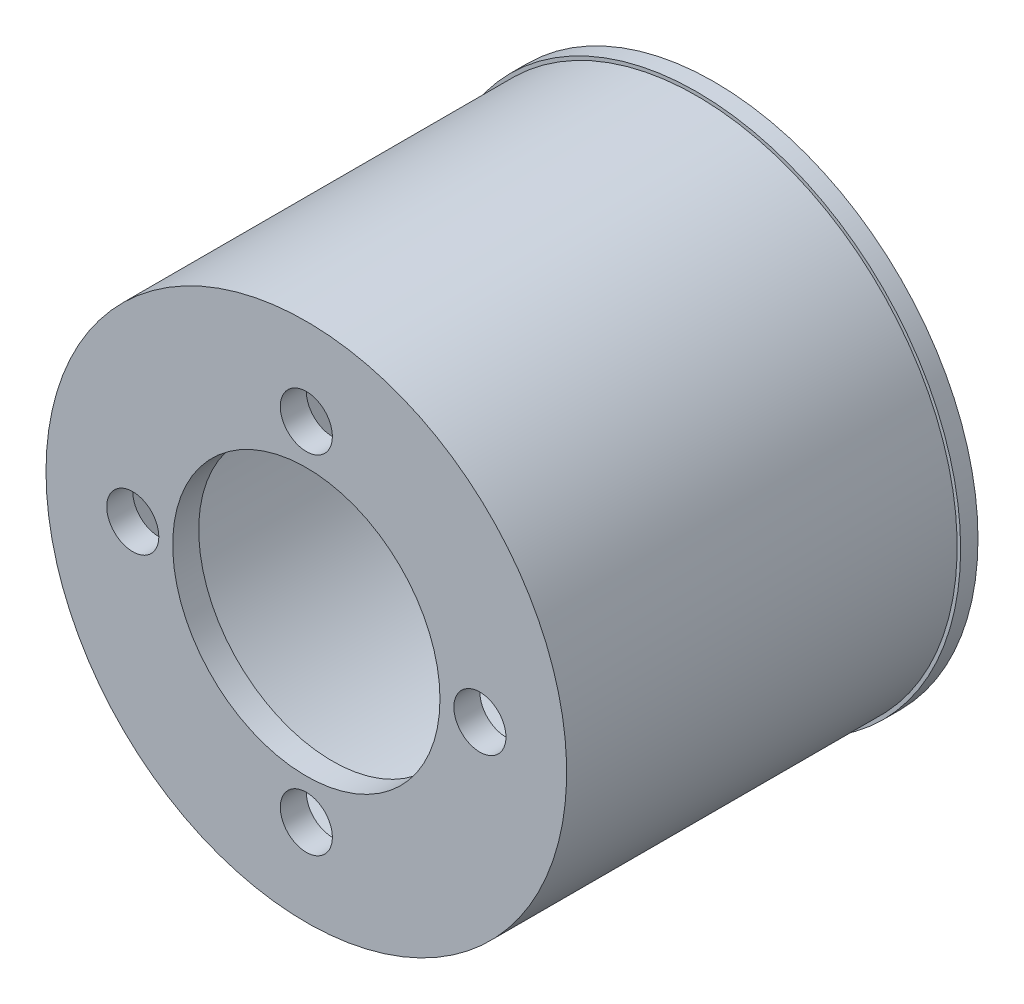
from build123d import *

# Parameters (mm, degrees)
ESQUISSE1_R        = 15
ESQUISSE1_R_2      = 13.35
BOSS_EXTRU_1_DEPTH = 21
BOSS_EXTRU_2_START = 1
ESQUISSE2_R        = 15.2
ESQUISSE2_R_2      = 13.35
BOSS_EXTRU_2_DEPTH = 1
ESQUISSE3_R        = 15
ESQUISSE3_R_2      = 7.7
ESQUISSE3_R_3      = 1.5
BOSS_EXTRU_3_DEPTH = 1.5


with BuildPart() as part:
    # Esquisse1 → Boss.-Extru.1 (new body)
    with BuildSketch(Plane.XY):
        with Locations(Location((0, 0, 0), (0, 0, 180))):
            Circle(ESQUISSE1_R)
        with Locations(Location((0, 0, 0), (0, 0, 180))):
            Circle(ESQUISSE1_R_2, mode=Mode.SUBTRACT)
    extrude(amount=BOSS_EXTRU_1_DEPTH)

    # Esquisse2 → Boss.-Extru.2 (add)
    with BuildSketch(Plane(origin=(0, 0, 0), x_dir=(-1, 0, 0), z_dir=(0, 0, -1)).offset(BOSS_EXTRU_2_START)):
        Circle(ESQUISSE2_R)
        Circle(ESQUISSE2_R_2, mode=Mode.SUBTRACT)
    extrude(amount=-BOSS_EXTRU_2_DEPTH)

    # Esquisse3 → Boss.-Extru.3 (add)
    with BuildSketch(Plane.XY.offset(21)):
        with Locations(Location((0, 0, 0), (0, 0, 180))):
            Circle(ESQUISSE3_R)
        Circle(ESQUISSE3_R_2, mode=Mode.SUBTRACT)
        with Locations((0, -10)):
            Circle(ESQUISSE3_R_3, mode=Mode.SUBTRACT)
        with Locations((0, 10)):
            Circle(ESQUISSE3_R_3, mode=Mode.SUBTRACT)
        with Locations((-10, 0)):
            Circle(ESQUISSE3_R_3, mode=Mode.SUBTRACT)
        with Locations((10, 0)):
            Circle(ESQUISSE3_R_3, mode=Mode.SUBTRACT)
    extrude(amount=BOSS_EXTRU_3_DEPTH)


solid = part.part
